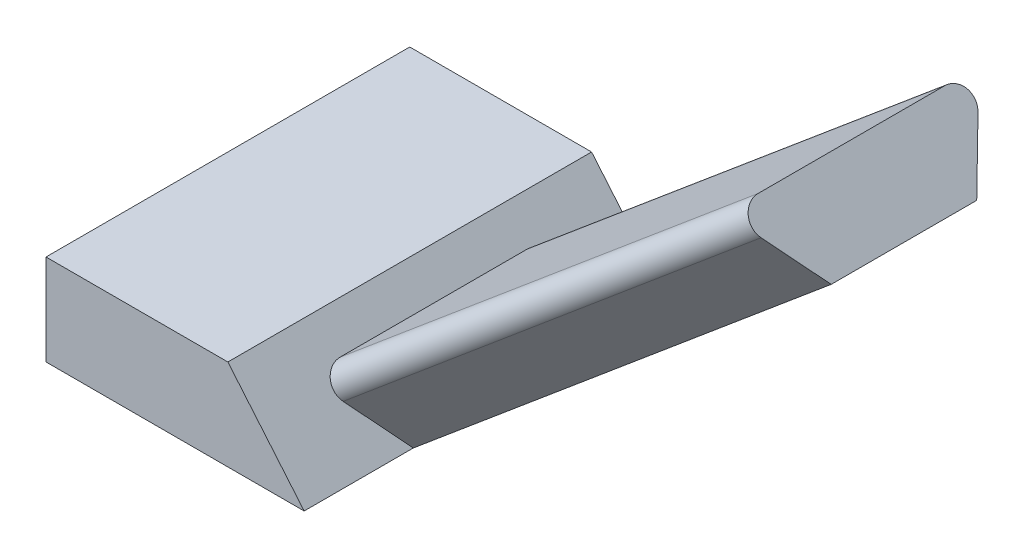
from build123d import *

# Parameters (mm, degrees)
BOSS_EXTRUDE2_DEPTH = 10
BOSS_EXTRUDE4_DEPTH = 30


with BuildPart() as part:
    # Sketch3 → Boss-Extrude2 (new, symmetric)
    with BuildSketch(Plane.XY):
        Polygon((0, 0), (0, 5), (10, 5), (14.195498156, 0), align=None)
    extrude(amount=BOSS_EXTRUDE2_DEPTH, both=True)

    # Sketch5 → Boss-Extrude4 (add)
    with BuildSketch(Plane(origin=(8.330260271, 6.989918321, 0), x_dir=(0, 0, -1), z_dir=(0.7660444431189745, 0.6427876096865437, 0))):
        with BuildLine():
            Line((-4, -9.124690328), (-5.963533203, -6.179390524))
            ThreePointArc((-5.963533203, -6.179390524), (-6.013157507, -5.152832402), (-5.131482908, -4.624690328))
            Line((-5.131482908, -4.624690328), (5.131482908, -4.624690328))
            ThreePointArc((5.131482908, -4.624690328), (6.013157507, -5.152832402), (5.963533203, -6.179390524))
            Line((5.963533203, -6.179390524), (4, -9.124690328))
            Line((4, -9.124690328), (-4, -9.124690328))
        make_face()
    extrude(amount=BOSS_EXTRUDE4_DEPTH)


solid = part.part
